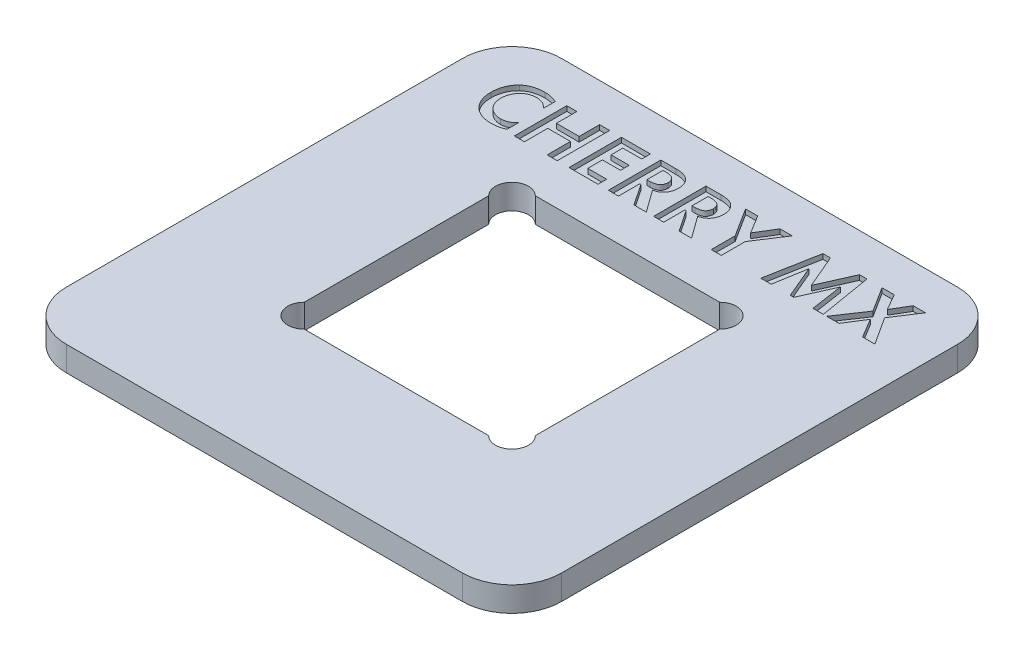
from build123d import *

# Parameters (mm, degrees)
SKETCH1_W           = 30
SKETCH1_H           = 30
BOSS_EXTRUDE1_DEPTH = 1.5
SKETCH2_W           = 14
SKETCH2_H           = 14
CUT_EXTRUDE1_DEPTH  = 22.266170318
CUT_EXTRUDE2_DEPTH  = 0.3
FILLET1_R           = 3
CUT_EXTRUDE3_DEPTH  = 22.266170459


with BuildPart() as part:
    # Sketch1 → Boss-Extrude1 (new body)
    with BuildSketch(Plane(origin=(0, 0, 0), x_dir=(1, 0, 0), z_dir=(0, 1, 0))):
        Rectangle(SKETCH1_W, SKETCH1_H)
    extrude(amount=-BOSS_EXTRUDE1_DEPTH)

    # Sketch2 → Cut-Extrude1 (cut, through all)
    with BuildSketch(Plane(origin=(0, 0, 0), x_dir=(1, 0, 0), z_dir=(0, 1, 0))):
        Rectangle(SKETCH2_W, SKETCH2_H)
    extrude(amount=-CUT_EXTRUDE1_DEPTH, mode=Mode.SUBTRACT)

    # Sketch4 → Cut-Extrude2 (cut)
    # profile 1 of 8: a face of its own
    with BuildSketch(Plane(origin=(0, 0, 0), x_dir=(1, 0, 0), z_dir=(0, 1, 0))):
        with BuildLine():
            add(Edge.make_bspline(
                [(-9.931675548, 10.334757863), (-9.956410127, 10.307542782), (-10.004962346, 10.254121513), (-10.085772608, 10.184107848), (-10.171143557, 10.124041158), (-10.262188382, 10.07475175), (-10.358565861, 10.036006671), (-10.459945918, 10.007763788), (-10.566354044, 9.98929371), (-10.639165801, 9.985869118), (-10.676282609, 9.984123384)],
                knots=[0, 0, 0, 0, 1.038303312, 2.038115554, 3.013713809, 3.982291951, 4.956416492, 5.942183339, 6.950999289, 8, 8, 8, 8], degree=3))
            add(Edge.make_bspline(
                [(-10.676282609, 9.984123384), (-10.710604024, 9.985141731), (-10.778573882, 9.987158457), (-10.879099806, 10.00053968), (-10.976674168, 10.022471867), (-11.070839568, 10.053821012), (-11.162112068, 10.09349606), (-11.250291129, 10.141868559), (-11.335685532, 10.198688974), (-11.416804651, 10.264224326), (-11.492837912, 10.336975396), (-11.55892721, 10.419618081), (-11.615747931, 10.509961801), (-11.663654226, 10.608165977), (-11.700687538, 10.714915988), (-11.728900747, 10.829017862), (-11.747820174, 10.951232942), (-11.752167098, 11.035486933), (-11.754402174, 11.078808167)],
                knots=[0, 0, 0, 0, 0.959792092, 1.900764613, 2.831095084, 3.75284142, 4.67209147, 5.610817336, 6.562008249, 7.536760042, 8.524172028, 9.498923821, 10.487906935, 11.503757305, 12.547747331, 13.641719212, 14.787432733, 16, 16, 16, 16], degree=3))
            add(Edge.make_bspline(
                [(-11.754402174, 11.078808167), (-11.753234962, 11.116358338), (-11.750941943, 11.190126658), (-11.735981687, 11.298678527), (-11.712517596, 11.403000371), (-11.680875663, 11.503322884), (-11.640549301, 11.59914292), (-11.591904634, 11.690901168), (-11.534654619, 11.778675307), (-11.468564348, 11.861207804), (-11.395255032, 11.936783297), (-11.315325874, 12.003916323), (-11.228424006, 12.06083857), (-11.134963186, 12.107704474), (-11.035200882, 12.145169805), (-10.929418783, 12.173566731), (-10.816971829, 12.191612403), (-10.739847104, 12.195608667), (-10.700440217, 12.197650558)],
                knots=[0, 0, 0, 0, 1.051748396, 2.066187949, 3.063699722, 4.044076182, 5.008800801, 5.971715509, 6.949483029, 7.939870149, 8.928851378, 9.894286105, 10.857739832, 11.831911316, 12.817021267, 13.837848258, 14.895248344, 16, 16, 16, 16], degree=3))
            add(Edge.make_bspline(
                [(-10.700440217, 12.197650558), (-10.681790519, 12.198057589), (-10.639036655, 12.198990697), (-10.566982908, 12.189700625), (-10.479888681, 12.169560629), (-10.397358614, 12.149267493), (-10.325386887, 12.125852711), (-10.269359057, 12.101395462), (-10.213336571, 12.071557669), (-10.157013908, 12.036078345), (-10.100918827, 11.994537704), (-10.043839404, 11.948239127), (-9.987371643, 11.895656141), (-9.950905585, 11.857559684), (-9.932228261, 11.838047297)],
                knots=[0, 0, 0, 0, 0.767001943, 1.758328457, 2.978528077, 4.446125656, 5.254616693, 6.090159384, 6.958538645, 7.864910871, 8.827044608, 9.829747705, 10.888431953, 12, 12, 12, 12], degree=3))
            Line((-9.932228261, 11.838047297), (-9.931675548, 12.540627264))
            add(Edge.make_bspline(
                [(-9.931675548, 12.540627264), (-9.967806672, 12.557384658), (-10.037976047, 12.589928786), (-10.143653644, 12.630940426), (-10.246340968, 12.663806248), (-10.346685277, 12.68702426), (-10.443612738, 12.703270747), (-10.536823742, 12.71538359), (-10.626723136, 12.721749349), (-10.685476916, 12.722062465), (-10.714244565, 12.722215775)],
                knots=[0, 0, 0, 0, 1.178650245, 2.289027858, 3.353014693, 4.367259811, 5.334579215, 6.261200975, 7.148630749, 8, 8, 8, 8], degree=3))
            add(Edge.make_bspline(
                [(-10.714244565, 12.722215775), (-10.770189824, 12.721446856), (-10.880268455, 12.71993392), (-11.042374627, 12.70324511), (-11.198222955, 12.673841623), (-11.348415764, 12.634371966), (-11.492432965, 12.581620269), (-11.628159219, 12.511953655), (-11.758475836, 12.430571156), (-11.837474899, 12.364718055), (-11.87726087, 12.331552732)],
                knots=[0, 0, 0, 0, 1.06926979, 2.103909373, 3.1106578, 4.098629268, 5.070062374, 6.035893056, 7.010824971, 8, 8, 8, 8], degree=3))
            add(Edge.make_bspline(
                [(-11.87726087, 12.331552732), (-11.910215608, 12.298871939), (-11.977772798, 12.231876339), (-12.067549545, 12.115252305), (-12.148709452, 11.982510467), (-12.209373679, 11.861073555), (-12.253292665, 11.756521073), (-12.281171232, 11.672317681), (-12.306563658, 11.584790811), (-12.325813497, 11.492818973), (-12.343068081, 11.397420876), (-12.354019053, 11.297769533), (-12.363001887, 11.194458534), (-12.364489538, 11.124153224), (-12.365244565, 11.08847121)],
                knots=[0, 0, 0, 0, 1.216016517, 2.492832969, 3.8473348, 5.290817446, 6.04820976, 6.81898805, 7.615384252, 8.436643923, 9.281713152, 10.156517211, 11.064378211, 12, 12, 12, 12], degree=3))
            add(Edge.make_bspline(
                [(-12.365244565, 11.08847121), (-12.364231656, 11.030662531), (-12.362239315, 10.916955837), (-12.341074632, 10.749342622), (-12.305025784, 10.588418596), (-12.255413719, 10.432882696), (-12.188920065, 10.283070561), (-12.102688556, 10.139773168), (-11.999962804, 10.000416966), (-11.918748741, 9.915624203), (-11.87726087, 9.872308167)],
                knots=[0, 0, 0, 0, 1.028719093, 2.023437465, 3.001248271, 3.961050289, 4.925455617, 5.911679893, 6.933190209, 8, 8, 8, 8], degree=3))
            add(Edge.make_bspline(
                [(-11.87726087, 9.872308167), (-11.844290177, 9.842772), (-11.777534599, 9.782970288), (-11.664204626, 9.706413371), (-11.541857029, 9.636394319), (-11.432032656, 9.58536664), (-11.338094925, 9.549452455), (-11.262167479, 9.52625134), (-11.181989932, 9.506224997), (-11.097654799, 9.489811363), (-11.009259759, 9.476457666), (-10.916358132, 9.468058601), (-10.819246682, 9.461447079), (-10.752908589, 9.460196145), (-10.719076087, 9.459558167)],
                knots=[0, 0, 0, 0, 1.263013207, 2.557215788, 3.896382155, 5.287038614, 6.010780935, 6.767369574, 7.553104443, 8.370172652, 9.220519574, 10.105212543, 11.033656286, 12, 12, 12, 12], degree=3))
            add(Edge.make_bspline(
                [(-10.719076087, 9.459558167), (-10.677645512, 9.460526421), (-10.597204653, 9.462406366), (-10.480322861, 9.471934585), (-10.371298756, 9.487692603), (-10.269879136, 9.509073154), (-10.176152634, 9.535684969), (-10.088658432, 9.56441343), (-10.007904273, 9.596845848), (-9.956963473, 9.621049983), (-9.932228261, 9.632802732)],
                knots=[0, 0, 0, 0, 1.223376888, 2.375286532, 3.459855312, 4.473708282, 5.432908354, 6.335094007, 7.19157528, 8, 8, 8, 8], degree=3))
            Line((-9.932228261, 9.632802732), (-9.931675548, 10.334757863))
        make_face()
    # profile 2 of 8: a face of its own
    with BuildSketch(Plane(origin=(0, 0, 0), x_dir=(1, 0, 0), z_dir=(0, 1, 0))):
        Polygon((-8.750317929, 12.678731406), (-9.360987092, 12.678731406), (-9.360987092, 9.503731406), (-8.750317929, 9.503731406), (-8.750317929, 10.917296623), (-7.373161679, 10.917296623), (-7.373161679, 9.503731406), (-6.762492517, 9.503731406), (-6.762492517, 12.678731406), (-7.373161679, 12.678731406), (-7.373161679, 11.44186184), (-8.750317929, 11.44186184), align=None)
    # profile 3 of 8: a face of its own
    with BuildSketch(Plane(origin=(0, 0, 0), x_dir=(1, 0, 0), z_dir=(0, 1, 0))):
        Polygon((-4.292268507, 12.678731406), (-6.047943614, 12.678731406), (-6.047943614, 9.50373208), (-4.292268507, 9.50373208), (-4.292268507, 10.028297297), (-5.437274451, 10.028297297), (-5.437274451, 10.917296623), (-4.339977088, 10.917296623), (-4.339977088, 11.44186184), (-5.437274451, 11.44186184), (-5.437274451, 12.154165514), (-4.292268507, 12.154165514), align=None)
    # profile 4 of 8: a face of its own
    with BuildSketch(Plane(origin=(0, 0, 0), x_dir=(1, 0, 0), z_dir=(0, 1, 0))):
        with BuildLine():
            Line((-3.66255231, 12.678731406), (-3.66255231, 9.503731406))
            Line((-3.66255231, 9.503731406), (-3.051883147, 9.503731406))
            Line((-3.051883147, 9.503731406), (-3.051883147, 10.784774884))
            Line((-3.051883147, 10.784774884), (-2.974028782, 10.784774884))
            Line((-2.974028782, 10.784774884), (-2.116829335, 9.503731406))
            Line((-2.116829335, 9.503731406), (-1.366379018, 9.503731406))
            Line((-1.366379018, 9.503731406), (-2.331730272, 10.846410488))
            add(Edge.make_bspline(
                [(-2.331730272, 10.846410488), (-2.296485162, 10.854351006), (-2.229830112, 10.869368), (-2.138414179, 10.901888338), (-2.058819856, 10.936660239), (-2.014768059, 10.968550949), (-1.994038043, 10.983558167)],
                knots=[0, 0, 0, 0, 1.178480206, 2.228724975, 3.166468549, 4, 4, 4, 4], degree=3))
            add(Edge.make_bspline(
                [(-1.994038043, 10.983558167), (-1.965519981, 11.005333613), (-1.909276487, 11.048279279), (-1.837071981, 11.125912906), (-1.774816539, 11.211010584), (-1.725440738, 11.305575589), (-1.68699575, 11.406749997), (-1.65845738, 11.513277854), (-1.641631554, 11.625384122), (-1.639607603, 11.701787359), (-1.638576087, 11.740726645)],
                knots=[0, 0, 0, 0, 0.988232282, 1.94899767, 2.912567974, 3.889217607, 4.881659609, 5.893097342, 6.9262067, 8, 8, 8, 8], degree=3))
            add(Edge.make_bspline(
                [(-1.638576087, 11.740726645), (-1.638854931, 11.771825299), (-1.639414697, 11.834254458), (-1.651963804, 11.927768483), (-1.671942942, 12.021570556), (-1.700766312, 12.115148257), (-1.739292458, 12.207793147), (-1.793434982, 12.294777867), (-1.859578042, 12.377751331), (-1.912356989, 12.426546344), (-1.93951087, 12.451650558)],
                knots=[0, 0, 0, 0, 0.934727435, 1.876423591, 2.832055104, 3.817155261, 4.818602944, 5.840574277, 6.889011788, 8, 8, 8, 8], degree=3))
            add(Edge.make_bspline(
                [(-1.93951087, 12.451650558), (-1.957834427, 12.46679348), (-1.996252083, 12.498542533), (-2.063224126, 12.539845431), (-2.141381147, 12.576542479), (-2.23052995, 12.611999589), (-2.334904637, 12.641095965), (-2.456038158, 12.661778408), (-2.594953247, 12.674563422), (-2.693428641, 12.676835944), (-2.745684783, 12.678041862)],
                knots=[0, 0, 0, 0, 0.666678986, 1.397776879, 2.200755583, 3.088210457, 4.0879526, 5.235700742, 6.533119708, 8, 8, 8, 8], degree=3))
            Line((-2.745684783, 12.678041862), (-3.66255231, 12.678731406))
        make_face()
        with BuildLine():
            Line((-3.051883147, 12.198339427), (-2.862113133, 12.198339427))
            add(Edge.make_bspline(
                [(-2.862113133, 12.198339427), (-2.840541791, 12.199413783), (-2.792072906, 12.201827766), (-2.71170613, 12.190354616), (-2.61671772, 12.167938084), (-2.529195015, 12.142857997), (-2.456300307, 12.114180246), (-2.406114924, 12.081851311), (-2.363927728, 12.039957879), (-2.326446885, 11.991225377), (-2.297008746, 11.933061341), (-2.274419587, 11.866550429), (-2.257966265, 11.791973662), (-2.252343396, 11.739193053), (-2.249418478, 11.711737514)],
                knots=[0, 0, 0, 0, 0.873171472, 1.961938597, 3.270820316, 4.827395458, 5.64597542, 6.434295099, 7.225089194, 8.043244746, 8.914294333, 9.851421081, 10.88234726, 12, 12, 12, 12], degree=3))
            add(Edge.make_bspline(
                [(-2.249418478, 11.711737514), (-2.252321731, 11.684279314), (-2.257855716, 11.631940347), (-2.274438876, 11.557752368), (-2.297790893, 11.491879114), (-2.327383078, 11.433625852), (-2.364345368, 11.383733408), (-2.408442641, 11.342594828), (-2.45880752, 11.309400414), (-2.532334433, 11.279565006), (-2.620943896, 11.25313352), (-2.717771106, 11.230872398), (-2.79987097, 11.217143278), (-2.849647055, 11.219800128), (-2.871994565, 11.220992949)],
                knots=[0, 0, 0, 0, 1.105972087, 2.108129301, 3.038528562, 3.90047476, 4.717450135, 5.513338718, 6.306176779, 7.119814993, 8.683134476, 10.007355833, 11.105380897, 12, 12, 12, 12], degree=3))
            Line((-2.871994565, 11.220992949), (-3.051883147, 11.220992949))
            Line((-3.051883147, 11.220992949), (-3.051883147, 12.198339427))
        make_face(mode=Mode.SUBTRACT)
    # profile 5 of 8: a face of its own
    with BuildSketch(Plane(origin=(0, 0, 0), x_dir=(1, 0, 0), z_dir=(0, 1, 0))):
        with BuildLine():
            Line((-0.923769701, 12.678731406), (-0.923769701, 9.503731406))
            Line((-0.923769701, 9.503731406), (-0.313100538, 9.503731406))
            Line((-0.313100538, 9.503731406), (-0.313100538, 10.784774884))
            Line((-0.313100538, 10.784774884), (-0.235246173, 10.784774884))
            Line((-0.235246173, 10.784774884), (0.621953274, 9.503731406))
            Line((0.621953274, 9.503731406), (1.372403591, 9.503731406))
            Line((1.372403591, 9.503731406), (0.407052336, 10.846410488))
            add(Edge.make_bspline(
                [(0.407052336, 10.846410488), (0.442297447, 10.854351006), (0.508952497, 10.869368), (0.60036843, 10.901888338), (0.679962753, 10.936660239), (0.72401455, 10.968550949), (0.744744565, 10.983558167)],
                knots=[0, 0, 0, 0, 1.178480206, 2.228724975, 3.166468549, 4, 4, 4, 4], degree=3))
            add(Edge.make_bspline(
                [(0.744744565, 10.983558167), (0.773262627, 11.005333613), (0.829506122, 11.048279279), (0.901710628, 11.125912906), (0.96396607, 11.211010584), (1.013341871, 11.305575589), (1.051786859, 11.406749997), (1.080325229, 11.513277854), (1.097151054, 11.625384122), (1.099175005, 11.701787359), (1.100206522, 11.740726645)],
                knots=[0, 0, 0, 0, 0.988232282, 1.94899767, 2.912567974, 3.889217607, 4.881659609, 5.893097342, 6.9262067, 8, 8, 8, 8], degree=3))
            add(Edge.make_bspline(
                [(1.100206522, 11.740726645), (1.099927678, 11.771825299), (1.099367911, 11.834254458), (1.086818805, 11.927768483), (1.066839667, 12.021570556), (1.038016297, 12.115148257), (0.99949015, 12.207793147), (0.945347627, 12.294777867), (0.879204567, 12.377751331), (0.82642562, 12.426546344), (0.799271739, 12.451650558)],
                knots=[0, 0, 0, 0, 0.934727435, 1.876423591, 2.832055104, 3.817155261, 4.818602944, 5.840574277, 6.889011788, 8, 8, 8, 8], degree=3))
            add(Edge.make_bspline(
                [(0.799271739, 12.451650558), (0.780948182, 12.46679348), (0.742530526, 12.498542533), (0.675558482, 12.539845431), (0.597401462, 12.576542479), (0.508252659, 12.611999589), (0.403877972, 12.641095965), (0.282744451, 12.661778408), (0.143829362, 12.674563422), (0.045353968, 12.676835944), (-0.006902174, 12.678041862)],
                knots=[0, 0, 0, 0, 0.666678986, 1.397776879, 2.200755583, 3.088210457, 4.0879526, 5.235700742, 6.533119708, 8, 8, 8, 8], degree=3))
            Line((-0.006902174, 12.678041862), (-0.923769701, 12.678731406))
        make_face()
        with BuildLine():
            Line((-0.313100538, 12.198339427), (-0.123330524, 12.198339427))
            add(Edge.make_bspline(
                [(-0.123330524, 12.198339427), (-0.101759182, 12.199413783), (-0.053290298, 12.201827766), (0.027076479, 12.190354616), (0.122064888, 12.167938084), (0.209587593, 12.142857997), (0.282482302, 12.114180246), (0.332667685, 12.081851311), (0.37485488, 12.039957879), (0.412335723, 11.991225377), (0.441773863, 11.933061341), (0.464363021, 11.866550429), (0.480816343, 11.791973662), (0.486439213, 11.739193053), (0.48936413, 11.711737514)],
                knots=[0, 0, 0, 0, 0.873171472, 1.961938597, 3.270820316, 4.827395458, 5.64597542, 6.434295099, 7.225089194, 8.043244746, 8.914294333, 9.851421081, 10.88234726, 12, 12, 12, 12], degree=3))
            add(Edge.make_bspline(
                [(0.48936413, 11.711737514), (0.486460877, 11.684279314), (0.480926892, 11.631940347), (0.464343733, 11.557752368), (0.440991716, 11.491879114), (0.41139953, 11.433625852), (0.374437241, 11.383733408), (0.330339968, 11.342594828), (0.279975089, 11.309400414), (0.206448176, 11.279565006), (0.117838713, 11.25313352), (0.021011503, 11.230872398), (-0.061088361, 11.217143278), (-0.110864446, 11.219800128), (-0.133211957, 11.220992949)],
                knots=[0, 0, 0, 0, 1.105972087, 2.108129301, 3.038528562, 3.90047476, 4.717450135, 5.513338718, 6.306176779, 7.119814993, 8.683134476, 10.007355833, 11.105380897, 12, 12, 12, 12], degree=3))
            Line((-0.133211957, 11.220992949), (-0.313100538, 11.220992949))
            Line((-0.313100538, 11.220992949), (-0.313100538, 12.198339427))
        make_face(mode=Mode.SUBTRACT)
    # profile 6 of 8: a face of its own
    with BuildSketch(Plane(origin=(0, 0, 0), x_dir=(1, 0, 0), z_dir=(0, 1, 0))):
        Polygon((2.565968755, 9.503731406), (3.176638592, 9.503731406), (3.176638592, 10.955553809), (4.297790246, 12.678731406), (3.563078098, 12.678731406), (2.885391119, 11.574363358), (2.208154398, 12.678731406), (1.47344225, 12.678731406), (2.565968755, 10.955553809), align=None)
    # profile 7 of 8: a face of its own
    with BuildSketch(Plane(origin=(0, 0, 0), x_dir=(1, 0, 0), z_dir=(0, 1, 0))):
        Polygon((5.569795516, 9.503731406), (6.19986154, 9.503731406), (6.529596722, 11.460121595), (7.358783723, 9.503731406), (7.572141782, 9.503731406), (8.440121157, 11.460121595), (8.731063965, 9.503731406), (9.360985744, 9.503731406), (8.826649637, 12.678731406), (8.372234502, 12.678731406), (7.475160846, 10.660429255), (6.616879564, 12.678731406), (6.161381921, 12.678731406), align=None)
    # profile 8 of 8: a face of its own
    with BuildSketch(Plane(origin=(0, 0, 0), x_dir=(1, 0, 0), z_dir=(0, 1, 0))):
        Polygon((9.564511575, 9.503731406), (10.308765439, 9.503731406), (11.043477587, 10.665189328), (11.74002287, 9.503731406), (12.484276733, 9.503731406), (11.396521086, 11.179277262), (12.374546997, 12.678731406), (11.630293133, 12.678731406), (11.043477587, 11.693365195), (10.485287189, 12.678731406), (9.741033325, 12.678731406), (10.690434087, 11.179277262), align=None)
    extrude(amount=-CUT_EXTRUDE2_DEPTH, mode=Mode.SUBTRACT)

    # Fillet1
    fillet1_edges = [part.edges().sort_by_distance(p)[0] for p in [
        (-15, -0.75, -15),
        (15, -0.75, -15),
        (15, -0.75, 15),
        (-15, -0.75, 15),
    ]]
    fillet(fillet1_edges, radius=FILLET1_R)

    # Sketch5 → Cut-Extrude3 (cut, through all)
    with BuildSketch(Plane(origin=(0, 0, 0), x_dir=(1, 0, 0), z_dir=(0, 1, 0))):
        with BuildLine():
            Line((-7, 5.585786438), (-5.585786438, 7))
            ThreePointArc((-5.585786438, 7), (-7, 7), (-7, 5.585786438))
        make_face()
        with BuildLine():
            Line((5.585786438, 7), (7, 5.585786438))
            ThreePointArc((7, 5.585786438), (7, 7), (5.585786438, 7))
        make_face()
        with BuildLine():
            Line((7, -5.585786438), (5.585786438, -7))
            ThreePointArc((5.585786438, -7), (7, -7), (7, -5.585786438))
        make_face()
        with BuildLine():
            Line((-5.585786438, -7), (-7, -5.585786438))
            ThreePointArc((-7, -5.585786438), (-7, -7), (-5.585786438, -7))
        make_face()
    extrude(amount=-CUT_EXTRUDE3_DEPTH, mode=Mode.SUBTRACT)


solid = part.part
